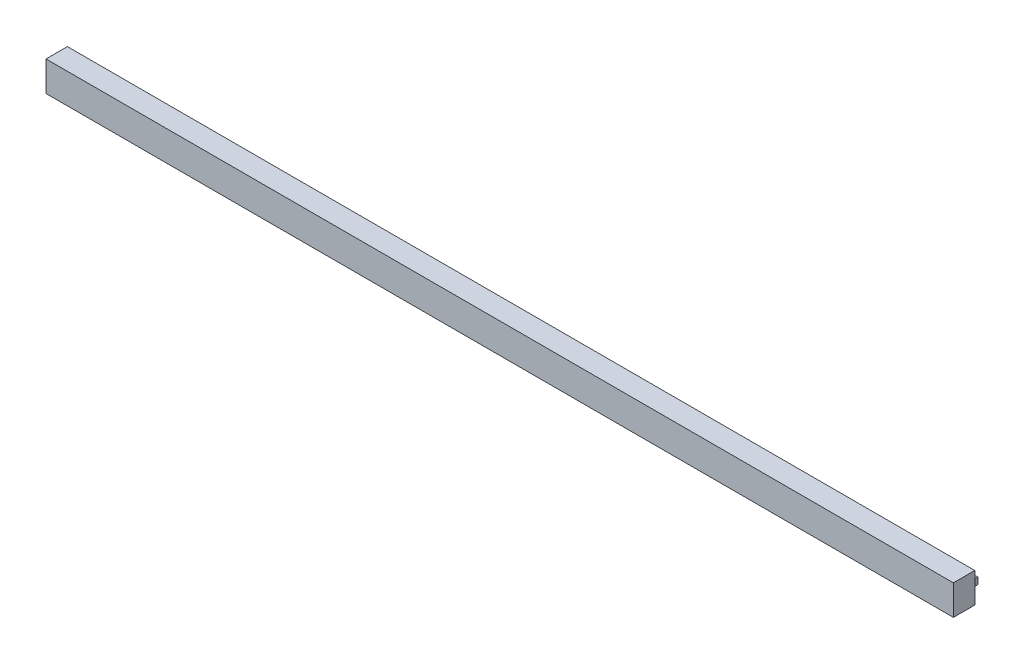
from build123d import *

# Parameters (mm, degrees)
SKETCH1_W           = 212
SKETCH1_H           = 7
BOSS_EXTRUDE1_DEPTH = 5
SKETCH2_W           = 1.5
SKETCH2_H           = 1.5
BOSS_EXTRUDE2_DEPTH = 2.5


with BuildPart() as part:
    # Sketch1 → Boss-Extrude1 (new body)
    with BuildSketch(Plane.XY):
        with Locations((106, 3.5)):
            Rectangle(SKETCH1_W, SKETCH1_H)
    extrude(amount=BOSS_EXTRUDE1_DEPTH)

    # Sketch2 → Boss-Extrude2 (add)
    with BuildSketch(Plane(origin=(0, 0, 0), x_dir=(-1, 0, 0), z_dir=(0, 0, -1))):
        with Locations((-2.5, 2.76849414)):
            Rectangle(SKETCH2_W, SKETCH2_H)
        with Locations((-209.5, 2.76849414)):
            Rectangle(SKETCH2_W, SKETCH2_H)
    extrude(amount=BOSS_EXTRUDE2_DEPTH)


solid = part.part
